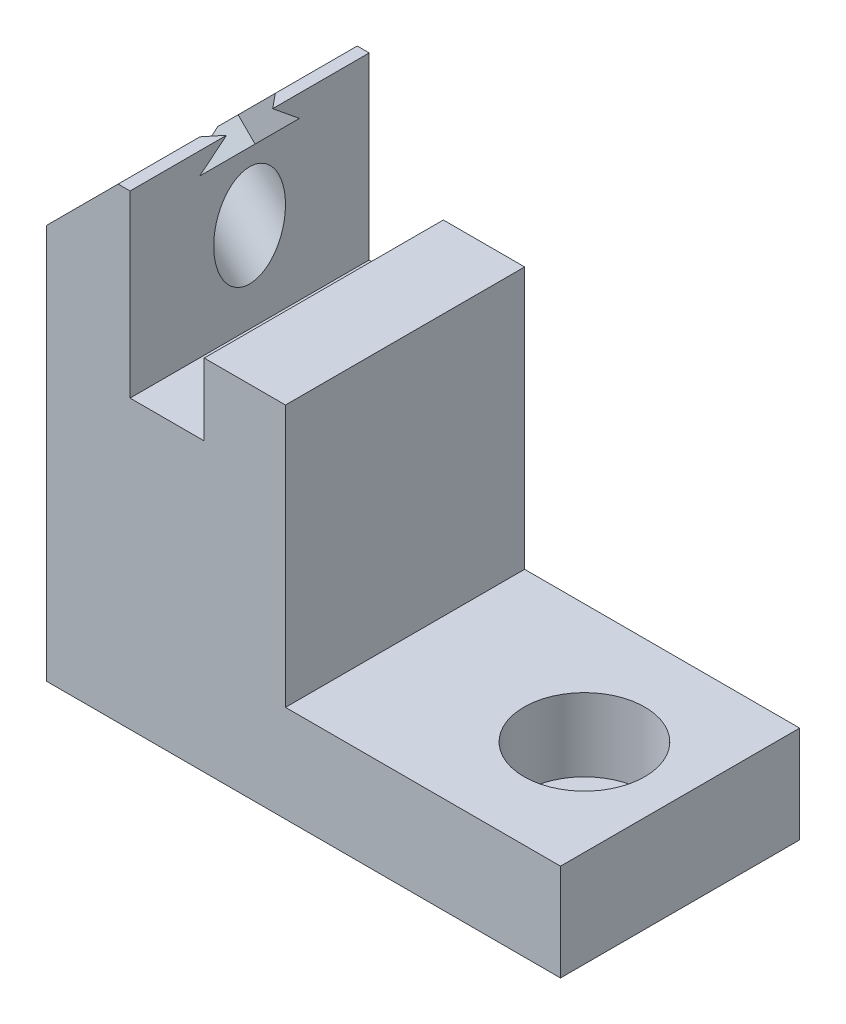
from build123d import *

# Parameters (mm, degrees)
SKETCH1_W           = 20
SKETCH1_H           = 20
BOSS_EXTRUDE1_DEPTH = 6
SKETCH2_W           = 6.8
SKETCH2_H           = 20
BOSS_EXTRUDE2_DEPTH = 6
SKETCH3_W           = 7
SKETCH3_H           = 20
BOSS_EXTRUDE3_DEPTH = 15
CHAMFER1_SIZE       = 6
SKETCH4_R           = 3
CUT_EXTRUDE1_DEPTH  = 10
SKETCH5_W           = 20
SKETCH5_H           = 20
BOSS_EXTRUDE4_DEPTH = 18
CUT_EXTRUDE2_DEPTH  = 2
SKETCH7_R           = 2.8
CUT_EXTRUDE3_DEPTH  = 20
CUT_EXTRUDE4_DEPTH  = 6
SKETCH9_W           = 20
SKETCH9_H           = 8.1
BOSS_EXTRUDE5_DEPTH = 23
CUT_EXTRUDE5_REACH  = 54.058
SKETCH10_R          = 3
SKETCH11_R          = 5.05
CUT_EXTRUDE6_DEPTH  = 6.1


with BuildPart() as part:
    # Sketch1 → Boss-Extrude1 (new body)
    with BuildSketch(Plane(origin=(0, 0, 0), x_dir=(1, 0, 0), z_dir=(0, 1, 0))):
        Rectangle(SKETCH1_W, SKETCH1_H)
    extrude(amount=BOSS_EXTRUDE1_DEPTH)

    # Sketch2 → Boss-Extrude2 (add)
    with BuildSketch(Plane(origin=(0, 6, 0), x_dir=(1, 0, 0), z_dir=(0, 1, 0))):
        with Locations((6.6, 0)):
            Rectangle(SKETCH2_W, SKETCH2_H)
    extrude(amount=BOSS_EXTRUDE2_DEPTH)

    # Sketch3 → Boss-Extrude3 (add)
    with BuildSketch(Plane(origin=(0, 6, 0), x_dir=(1, 0, 0), z_dir=(0, 1, 0))):
        with Locations((-6.5, 0)):
            Rectangle(SKETCH3_W, SKETCH3_H)
    extrude(amount=BOSS_EXTRUDE3_DEPTH)

    # Chamfer1
    chamfer1_edges = [part.edges().sort_by_distance(p)[0] for p in [
        (-10, 21, 0),
    ]]
    chamfer(chamfer1_edges, length=CHAMFER1_SIZE)

    # Sketch4 → Cut-Extrude1 (cut)
    with BuildSketch(Plane(origin=(-12.5, 12.5, 0), x_dir=(0, 0, 1), z_dir=(-0.7071067811865489, 0.7071067811865462, 0))):
        with Locations(Location((0, 7.432512212, 0), (0, 0, 270))):
            Circle(SKETCH4_R)
    extrude(amount=-CUT_EXTRUDE1_DEPTH, mode=Mode.SUBTRACT)

    # Sketch5 → Boss-Extrude4 (add)
    with BuildSketch(Plane.XZ):
        Rectangle(SKETCH5_W, SKETCH5_H)
    extrude(amount=BOSS_EXTRUDE4_DEPTH)

    # Sketch6 → Cut-Extrude2 (cut)
    with BuildSketch(Plane(origin=(-12.5, 12.5, 0), x_dir=(0, 0, 1), z_dir=(-0.7071067811865489, 0.7071067811865462, 0))):
        Polygon((0, 13.8411002), (-5.55, 10.636806206), (-5.55, 4.228218218), (0, 1.023924224), (5.55, 4.228218218), (5.55, 10.636806206), align=None)
    extrude(amount=-CUT_EXTRUDE2_DEPTH, mode=Mode.SUBTRACT)

    # Sketch7 → Cut-Extrude3 (cut)
    with BuildSketch(Plane(origin=(0, -18, 0), x_dir=(-1, 0, 0), z_dir=(0, -1, 0))):
        with Locations(Location((0, 0, 0), (0, 0, 90))):
            Circle(SKETCH7_R)
    extrude(amount=-CUT_EXTRUDE3_DEPTH, mode=Mode.SUBTRACT)

    # Sketch8 → Cut-Extrude4 (cut)
    with BuildSketch(Plane(origin=(0, -18, 0), x_dir=(-1, 0, 0), z_dir=(0, -1, 0))):
        Polygon((5.088506171, -2.964305137), (5.111416639, 2.924623043), (0.022910468, 5.88892818), (-5.088506171, 2.964305137), (-5.111416639, -2.924623043), (-0.022910468, -5.88892818), align=None)
    extrude(amount=-CUT_EXTRUDE4_DEPTH, mode=Mode.SUBTRACT)

    # Sketch9 → Boss-Extrude5 (add)
    with BuildSketch(Plane(origin=(10, 0, 0), x_dir=(0, 0, -1), z_dir=(1, 0, 0))):
        with Locations((0, -13.95)):
            Rectangle(SKETCH9_W, SKETCH9_H)
    extrude(amount=BOSS_EXTRUDE5_DEPTH)

    # Sketch10 → Cut-Extrude5 (cut, up to next)
    with BuildSketch(Plane.XZ.offset(18), mode=Mode.PRIVATE) as cut_extrude5_sk1:
        with Locations(Location((25, 0, 0), (0, 0, 270))):
            Circle(SKETCH10_R)
    cut_extrude5_tool1 = extrude(cut_extrude5_sk1.sketch, amount=-CUT_EXTRUDE5_REACH, mode=Mode.PRIVATE) & part.part
    add(cut_extrude5_tool1.solids().sort_by_distance((25, -18, 0))[0], mode=Mode.SUBTRACT)

    # Sketch11 → Cut-Extrude6 (cut)
    with BuildSketch(Plane(origin=(0, -9.9, 0), x_dir=(1, 0, 0), z_dir=(0, 1, 0))):
        with Locations(Location((25, 0, 0), (0, 0, 270))):
            Circle(SKETCH11_R)
    extrude(amount=-CUT_EXTRUDE6_DEPTH, mode=Mode.SUBTRACT)


solid = part.part
